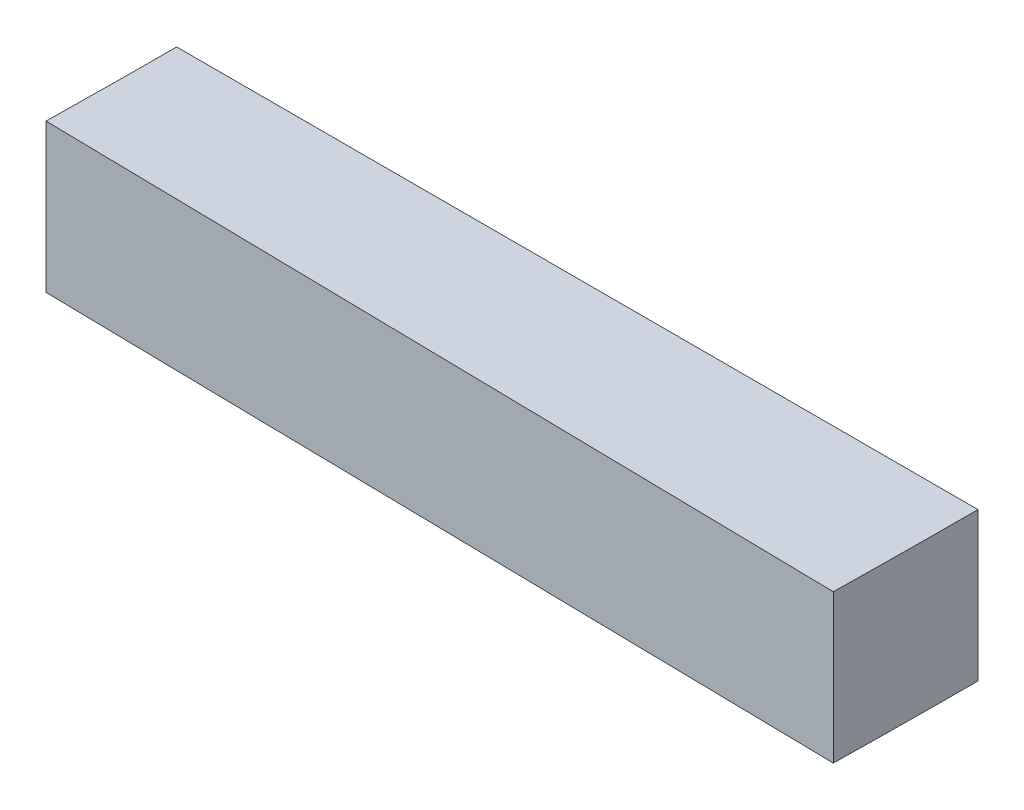
from build123d import *

# Parameters (mm, degrees)
SKETCH1_W      = 13.716
SKETCH1_H      = 2.54
REVOLVE1_ANGLE = 1


with BuildPart() as part:
    # Sketch1 → Revolve1 (revolve)
    with BuildSketch(Plane.XY):
        with Locations((6.858, 1.27)):
            Rectangle(SKETCH1_W, SKETCH1_H)
    revolve(axis=Axis((-127, 22.150165738, 0), (0, -1, 0)), revolution_arc=REVOLVE1_ANGLE)


solid = part.part
